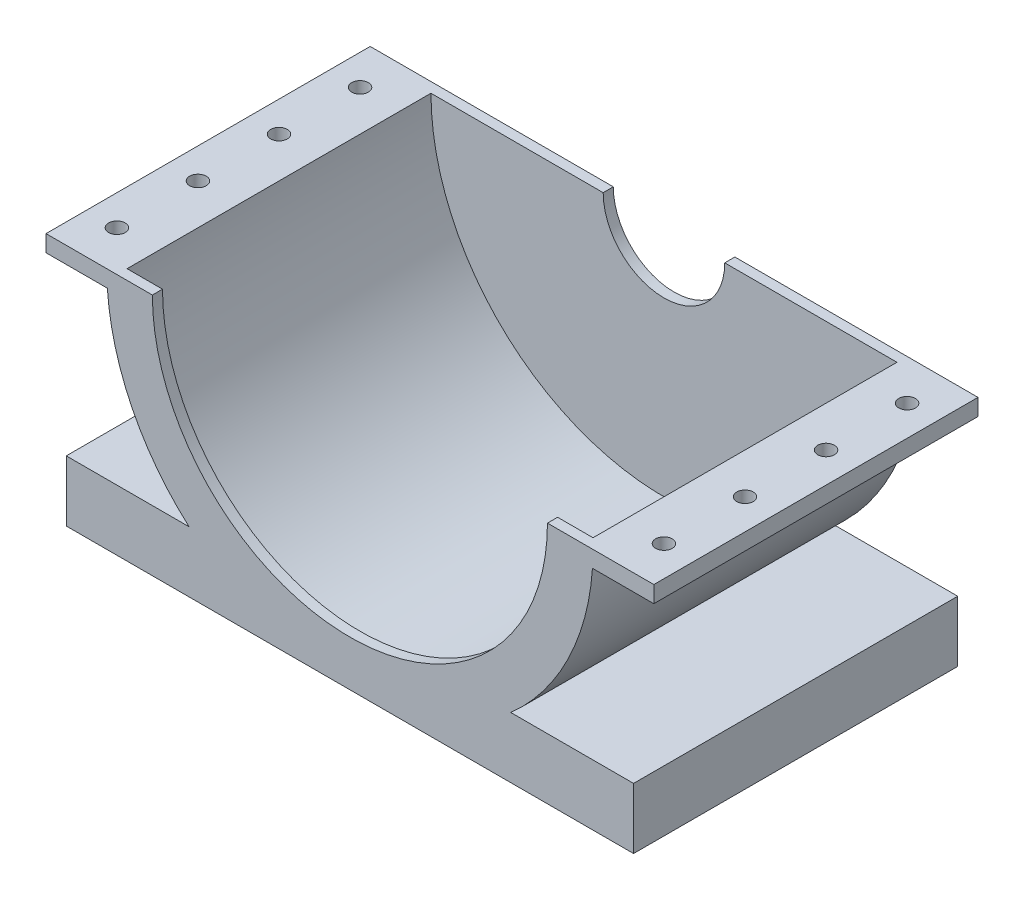
from build123d import *

# Parameters (mm, degrees)
BOSS_EXTRUDE1_DEPTH = 80
BOSS_EXTRUDE2_DEPTH = 2.5
SKETCH4_W           = 8.75
SKETCH4_H           = 75
SKETCH5_R           = 2.05
CUT_EXTRUDE1_DEPTH  = 4.1


with BuildPart() as part:
    # Sketch1 → Boss-Extrude1 (new body)
    with BuildSketch(Plane.XY):
        with BuildLine():
            Line((-70, 0), (70, 0))
            Line((70, 0), (70, 15))
            Line((70, 15), (39.686269666, 15))
            ThreePointArc((39.686269666, 15), (53.810362803, 33.458619949), (59.859752756, 55.9))
            Line((59.859752756, 55.9), (75, 55.9))
            Line((75, 55.9), (75, 60))
            Line((75, 60), (48.75, 60))
            ThreePointArc((48.75, 60), (0, 11.25), (-48.75, 60))
            Line((-48.75, 60), (-75, 60))
            Line((-75, 60), (-75, 55.9))
            Line((-75, 55.9), (-59.859752756, 55.9))
            ThreePointArc((-59.859752756, 55.9), (-53.810362803, 33.458619949), (-39.686269666, 15))
            Line((-39.686269666, 15), (-70, 15))
            Line((-70, 15), (-70, 0))
        make_face()
    extrude(amount=BOSS_EXTRUDE1_DEPTH)

    # Sketch3 → Boss-Extrude2 (add)
    with BuildSketch(Plane(origin=(0, 0, 0), x_dir=(-1, 0, 0), z_dir=(0, 0, -1))):
        with BuildLine():
            ThreePointArc((-15, 60), (0, 45), (15, 60))
            Line((15, 60), (48.75, 60))
            ThreePointArc((48.75, 60), (0, 11.25), (-48.75, 60))
            Line((-48.75, 60), (-15, 60))
        make_face()
    extrude(amount=-BOSS_EXTRUDE2_DEPTH)

    # Sketch4 → Cut-Revolve1 (revolve, cut)
    with BuildSketch(Plane(origin=(0, 60, 0), x_dir=(1, 0, 0), z_dir=(0, 1, 0))):
        with Locations((-53.125, -40)):
            Rectangle(SKETCH4_W, SKETCH4_H)
    revolve(axis=Axis((0, 60, 0), (0, 0, 1)), mode=Mode.SUBTRACT)

    # Sketch5 → Cut-Extrude1 (cut)
    with BuildSketch(Plane(origin=(0, 60, 0), x_dir=(1, 0, 0), z_dir=(0, 1, 0))):
        with Locations(Location((67.5, -70, 0), (0, 0, 270))):
            Circle(SKETCH5_R)
        with Locations(Location((67.5, -50, 0), (0, 0, 270))):
            Circle(SKETCH5_R)
        with Locations(Location((67.5, -30, 0), (0, 0, 270))):
            Circle(SKETCH5_R)
        with Locations(Location((67.5, -10, 0), (0, 0, 270))):
            Circle(SKETCH5_R)
        with Locations(Location((-67.5, -10, 0), (0, 0, 180))):
            Circle(SKETCH5_R)
        with Locations(Location((-67.5, -30, 0), (0, 0, 180))):
            Circle(SKETCH5_R)
        with Locations(Location((-67.5, -50, 0), (0, 0, 180))):
            Circle(SKETCH5_R)
        with Locations(Location((-67.5, -70, 0), (0, 0, 180))):
            Circle(SKETCH5_R)
    extrude(amount=-CUT_EXTRUDE1_DEPTH, mode=Mode.SUBTRACT)


solid = part.part
